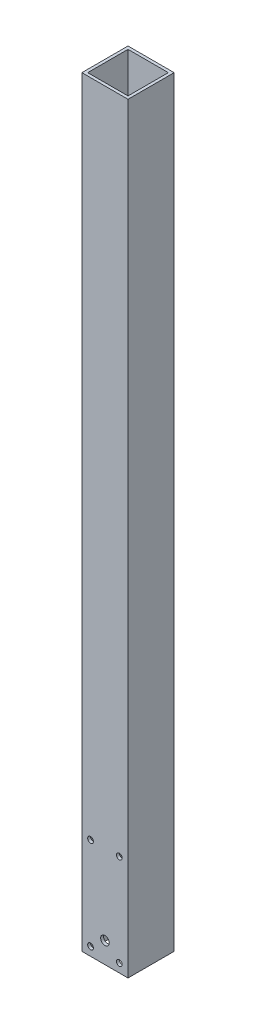
from build123d import *

# Parameters (mm, degrees)
SKETCH1_W           = 50.8
SKETCH1_H           = 50.8
SKETCH1_W_2         = 44.45
SKETCH1_H_2         = 44.45
BOSS_EXTRUDE1_DEPTH = 838.2
SKETCH2_R           = 3.175
SKETCH2_R_2         = 4.7625
CUT_EXTRUDE1_DEPTH  = 842.273154213


with BuildPart() as part:
    # Sketch1 → Boss-Extrude1 (new body)
    with BuildSketch(Plane(origin=(0, 0, 0), x_dir=(1, 0, 0), z_dir=(0, 1, 0))):
        with Locations((25.4, 25.4)):
            Rectangle(SKETCH1_W, SKETCH1_H)
        with Locations((25.4, 25.4)):
            Rectangle(SKETCH1_W_2, SKETCH1_H_2, mode=Mode.SUBTRACT)
    extrude(amount=BOSS_EXTRUDE1_DEPTH)

    # Sketch2 → Cut-Extrude1 (cut, through all)
    with BuildSketch(Plane.XY):
        with Locations((9.525, 111.125)):
            Circle(SKETCH2_R)
        with Locations((41.275, 111.125)):
            Circle(SKETCH2_R)
        with Locations((9.525, 9.525)):
            Circle(SKETCH2_R)
        with Locations((41.275, 9.525)):
            Circle(SKETCH2_R)
        with Locations((25.4, 23.114)):
            Circle(SKETCH2_R_2)
    extrude(amount=-CUT_EXTRUDE1_DEPTH, mode=Mode.SUBTRACT)


solid = part.part
